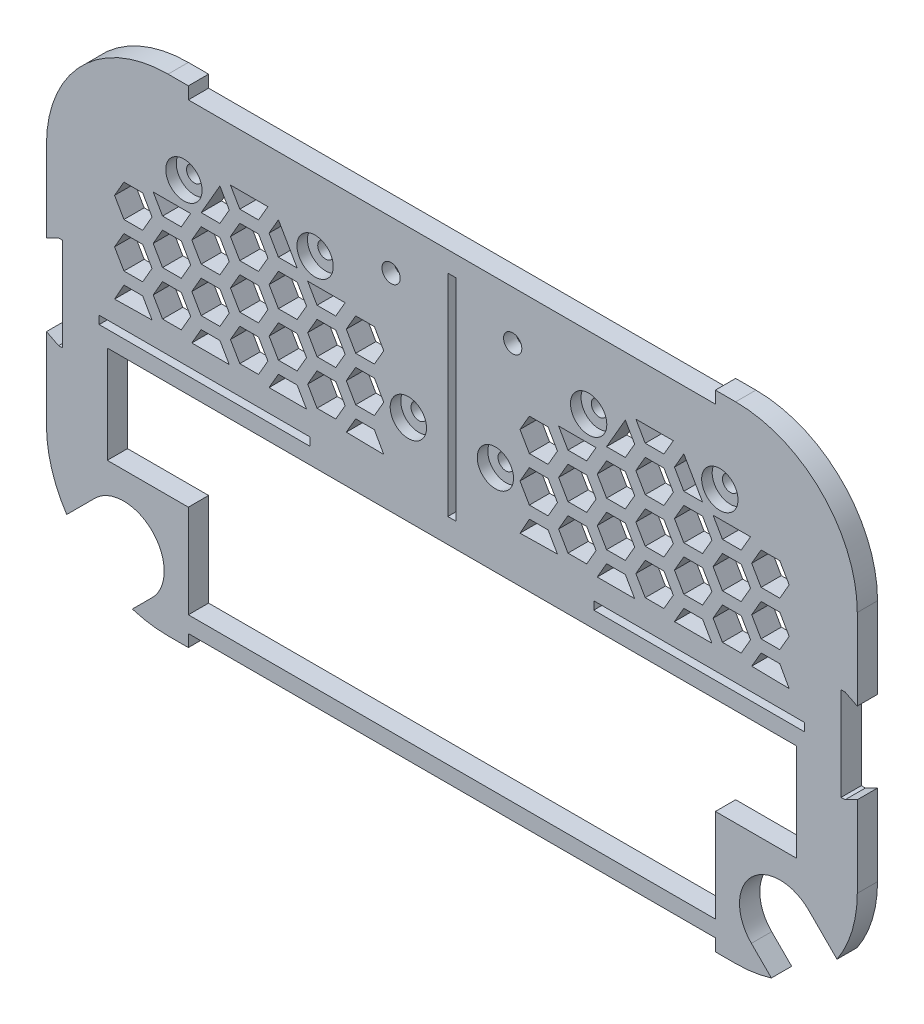
from build123d import *

# Parameters (mm, degrees)
EXTRUDE_1_DEPTH                = 5
SKETCH_2_R                     = 10
CUT_EXTRUDE_670_DEPTH          = 4
CUT_EXTRUDE_4_REACH            = 118.726
SKETCH_3_W                     = 130
SKETCH_3_H                     = 3
HOLE_WIZARD_M3_5_1_D           = 3.9
HOLE_WIZARD_M3_5_1_CBORE_D     = 8.96
HOLE_WIZARD_M3_5_1_CBORE_DEPTH = 2.6
CUT_EXTRUDE_5_DEPTH            = 117.726175299
CUT_EXTRUDE_5_DEPTH_BACK       = 117.726175299
SKETCH_8_W                     = 40
SKETCH_8_H                     = 5
CUT_EXTRUDE_7_DEPTH            = 3
HOLE_WIZARD_M4_1_D             = 4.5
HOLE_WIZARD_M4_1_CBORE_D       = 8
HOLE_WIZARD_M4_1_CBORE_DEPTH   = 2
CUT_EXTRUDE_8_DEPTH            = 10


with BuildPart() as part:
    # 草图1 → 凸台-拉伸1 (new body)
    with BuildSketch(Plane.XY):
        with BuildLine():
            Line((70, 60), (-70, 60))
            ThreePointArc((-70, 60), (-91.213203436, 51.213203436), (-100, 30))
            Line((-100, 30), (-100, -30))
            ThreePointArc((-100, -30), (-91.213203436, -51.213203436), (-70, -60))
            Line((-70, -60), (70, -60))
            ThreePointArc((70, -60), (91.213203436, -51.213203436), (100, -30))
            Line((100, -30), (100, 30))
            ThreePointArc((100, 30), (91.213203436, 51.213203436), (70, 60))
        make_face()
    extrude(amount=EXTRUDE_1_DEPTH)

    # 草图2 → Cut-Extrude 670 (cut)
    with BuildSketch(Plane.XY):
        with Locations((-80.94997709, 46.6721258)):
            Circle(SKETCH_2_R)
        with Locations((80.94997709, 46.6721258)):
            Circle(SKETCH_2_R)
    extrude(amount=CUT_EXTRUDE_670_DEPTH, mode=Mode.SUBTRACT)

    # 草图3 → 切除-拉伸4 (cut, up to next)
    with BuildSketch(Plane.XY, mode=Mode.PRIVATE) as cut_extrude_4_sk1:
        Polygon((-85, -6), (-85, -30), (-70, -30), (-65, -30), (-65, -53), (65, -53), (65, -30), (70, -30), (85, -30), (85, -6), align=None)
    cut_extrude_4_tool1 = extrude(cut_extrude_4_sk1.sketch, amount=CUT_EXTRUDE_4_REACH, mode=Mode.PRIVATE) & part.part
    # 草图3 → 切除-拉伸4 (cut, up to next)
    with BuildSketch(Plane.XY, mode=Mode.PRIVATE) as cut_extrude_4_sk2:
        with Locations((0, -58.5)):
            Rectangle(SKETCH_3_W, SKETCH_3_H)
    cut_extrude_4_tool2 = extrude(cut_extrude_4_sk2.sketch, amount=CUT_EXTRUDE_4_REACH, mode=Mode.PRIVATE) & part.part
    # 草图3 → 切除-拉伸4 (cut, up to next)
    with BuildSketch(Plane.XY, mode=Mode.PRIVATE) as cut_extrude_4_sk3:
        Polygon((-100, -10), (-97, -11.5), (-96, -11.5), (-96, 11.5), (-97, 11.5), (-100, 10), align=None)
    cut_extrude_4_tool3 = extrude(cut_extrude_4_sk3.sketch, amount=CUT_EXTRUDE_4_REACH, mode=Mode.PRIVATE) & part.part
    # 草图3 → 切除-拉伸4 (cut, up to next)
    with BuildSketch(Plane.XY, mode=Mode.PRIVATE) as cut_extrude_4_sk4:
        Polygon((87, 0), (87, -2), (35, -2), (35, 0), (37, 0), align=None)
    cut_extrude_4_tool4 = extrude(cut_extrude_4_sk4.sketch, amount=CUT_EXTRUDE_4_REACH, mode=Mode.PRIVATE) & part.part
    # 草图3 → 切除-拉伸4 (cut, up to next)
    with BuildSketch(Plane.XY, mode=Mode.PRIVATE) as cut_extrude_4_sk5:
        Polygon((-35, 0), (-35, -2), (-87, -2), (-87, 0), (-37, 0), align=None)
    cut_extrude_4_tool5 = extrude(cut_extrude_4_sk5.sketch, amount=CUT_EXTRUDE_4_REACH, mode=Mode.PRIVATE) & part.part
    # 草图3 → 切除-拉伸4 (cut, up to next)
    with BuildSketch(Plane.XY, mode=Mode.PRIVATE) as cut_extrude_4_sk6:
        Polygon((97, 11.5), (96, 11.5), (96, -11.5), (97, -11.5), (100, -10), (100, 10), align=None)
    cut_extrude_4_tool6 = extrude(cut_extrude_4_sk6.sketch, amount=CUT_EXTRUDE_4_REACH, mode=Mode.PRIVATE) & part.part
    # 草图3 → 切除-拉伸4 (cut, up to next)
    with BuildSketch(Plane.XY, mode=Mode.PRIVATE) as cut_extrude_4_sk7:
        Polygon((0, 0), (-1, 0), (-1, 50), (-1, 52), (1, 52), (1, 50), (1, 0), align=None)
    cut_extrude_4_tool7 = extrude(cut_extrude_4_sk7.sketch, amount=CUT_EXTRUDE_4_REACH, mode=Mode.PRIVATE) & part.part
    # 草图3 → 切除-拉伸4 (cut, up to next)
    with BuildSketch(Plane.XY, mode=Mode.PRIVATE) as cut_extrude_4_sk8:
        with Locations((0, 58.5)):
            Rectangle(SKETCH_3_W, SKETCH_3_H)
    cut_extrude_4_tool8 = extrude(cut_extrude_4_sk8.sketch, amount=CUT_EXTRUDE_4_REACH, mode=Mode.PRIVATE) & part.part
    add(cut_extrude_4_tool1.solids().sort_by_distance((0, -27.938472, 0))[0], mode=Mode.SUBTRACT)
    add(cut_extrude_4_tool2.solids().sort_by_distance((0, -58.5, 0))[0], mode=Mode.SUBTRACT)
    add(cut_extrude_4_tool3.solids().sort_by_distance((-97.948571, 0, 0))[0], mode=Mode.SUBTRACT)
    add(cut_extrude_4_tool4.solids().sort_by_distance((61, -1, 0))[0], mode=Mode.SUBTRACT)
    add(cut_extrude_4_tool5.solids().sort_by_distance((-61, -1, 0))[0], mode=Mode.SUBTRACT)
    add(cut_extrude_4_tool6.solids().sort_by_distance((97.948571, 0, 0))[0], mode=Mode.SUBTRACT)
    add(cut_extrude_4_tool7.solids().sort_by_distance((0, 26, 0))[0], mode=Mode.SUBTRACT)
    add(cut_extrude_4_tool8.solids().sort_by_distance((0, 58.5, 0))[0], mode=Mode.SUBTRACT)

    # M3.5 六角头机械螺钉的柱形沉头孔1 (through all)
    with Locations(Plane(origin=(-66.09513153, 39.33442184, 5), x_dir=(1, 0, 0), z_dir=(0, 0, 1))):
        with Locations((0, 0), (32.35917741, -0.06954171), (55.361697855, -23.07037596), (99.83108565, -0.06954171), (76.8285652, -23.07037596), (132.19026306, 0)):
            CounterBoreHole(HOLE_WIZARD_M3_5_1_D / 2, HOLE_WIZARD_M3_5_1_CBORE_D / 2, HOLE_WIZARD_M3_5_1_CBORE_DEPTH)

    # 草图5 → 切除-拉伸5 (cut, two sides: drawn at the far end of the back side and taken through both)
    with BuildSketch(Plane.XY.offset(-CUT_EXTRUDE_5_DEPTH_BACK)):
        Polygon((-35.854918405, 5.5), (-38.164319482, 9.5), (-42.783121635, 9.5), (-45.092522712, 5.5), align=None)
        Polygon((-26.328638963, 11), (-28.63804004, 15), (-33.256842194, 15), (-35.56624327, 11), (-33.256842194, 7), (-28.63804004, 7), align=None)
        Polygon((-16.802359522, 16.5), (-19.111760598, 20.5), (-23.730562752, 20.5), (-26.039963829, 16.5), (-23.730562752, 12.5), (-19.111760598, 12.5), align=None)
        Polygon((-35.854918405, 16.5), (-38.164319482, 20.5), (-42.783121635, 20.5), (-45.092522712, 16.5), (-42.783121635, 12.5), (-38.164319482, 12.5), align=None)
        Polygon((-26.328638963, 22), (-28.63804004, 26), (-33.256842194, 26), (-35.56624327, 22), (-33.256842194, 18), (-28.63804004, 18), align=None)
        Polygon((-16.802359522, 27.5), (-19.111760598, 31.5), (-23.730562752, 31.5), (-26.039963829, 27.5), (-23.730562752, 23.5), (-19.111760598, 23.5), align=None)
        Polygon((-35.854918405, 27.5), (-38.164319482, 31.5), (-42.783121635, 31.5), (-45.092522712, 27.5), (-42.783121635, 23.5), (-38.164319482, 23.5), align=None)
        Polygon((-35.56624327, 33), (-33.256842194, 29), (-28.63804004, 29), (-26.328638963, 33), align=None)
        Polygon((-42.783121635, 42.5), (-45.092522712, 38.5), (-42.783121635, 34.5), (-38.164319482, 34.5), align=None)
        Polygon((-45.381197846, 11), (-47.690598923, 15), (-52.309401077, 15), (-54.618802154, 11), (-52.309401077, 7), (-47.690598923, 7), align=None)
        Polygon((-45.381197846, 22), (-47.690598923, 26), (-52.309401077, 26), (-54.618802154, 22), (-52.309401077, 18), (-47.690598923, 18), align=None)
        Polygon((-45.381197846, 33), (-47.690598923, 37), (-52.309401077, 37), (-54.618802154, 33), (-52.309401077, 29), (-47.690598923, 29), align=None)
        Polygon((-54.907477288, 5.5), (-64.145081595, 5.5), (-61.835680518, 9.5), (-57.216878365, 9.5), align=None)
        Polygon((-64.43375673, 33), (-73.671361037, 33), (-71.36195996, 29), (-66.743157806, 29), align=None)
        Polygon((-57.216878365, 42.5), (-61.835680518, 34.5), (-57.216878365, 34.5), (-54.907477288, 38.5), align=None)
        Polygon((-61.835680518, 23.5), (-64.145081595, 27.5), (-61.835680518, 31.5), (-57.216878365, 31.5), (-54.907477288, 27.5), (-57.216878365, 23.5), align=None)
        Polygon((-80.888239402, 23.5), (-83.197640478, 27.5), (-80.888239402, 31.5), (-76.269437248, 31.5), (-73.960036171, 27.5), (-76.269437248, 23.5), align=None)
        Polygon((-71.36195996, 18), (-73.671361037, 22), (-71.36195996, 26), (-66.743157806, 26), (-64.43375673, 22), (-66.743157806, 18), align=None)
        Polygon((-61.835680518, 12.5), (-64.145081595, 16.5), (-61.835680518, 20.5), (-57.216878365, 20.5), (-54.907477288, 16.5), (-57.216878365, 12.5), align=None)
        Polygon((-80.888239402, 12.5), (-83.197640478, 16.5), (-80.888239402, 20.5), (-76.269437248, 20.5), (-73.960036171, 16.5), (-76.269437248, 12.5), align=None)
        Polygon((-71.36195996, 7), (-73.671361037, 11), (-71.36195996, 15), (-66.743157806, 15), (-64.43375673, 11), (-66.743157806, 7), align=None)
        Polygon((-52.309401077, 40), (-47.690598923, 40), (-45.381197846, 44), (-52.309401077, 44), (-54.618802154, 44), align=None)
        Polygon((-21.421161675, 9.5), (-23.730562752, 9.5), (-26.039963829, 5.5), (-16.802359522, 5.34174435), (-19.111760598, 9.5), align=None)
        Polygon((-80.888239402, 9.5), (-78.578838325, 9.5), (-76.269437248, 9.5), (-73.960036171, 5.5), (-83.197640478, 5.34174435), align=None)
        Polygon((78.578838325, 9.5), (76.269437248, 9.5), (73.960036171, 5.5), (83.197640478, 5.34174435), (80.888239402, 9.5), align=None)
        Polygon((19.111760598, 9.5), (21.421161675, 9.5), (23.730562752, 9.5), (26.039963829, 5.5), (16.802359522, 5.34174435), align=None)
        Polygon((45.381197846, 44), (47.690598923, 40), (52.309401077, 40), (54.618802154, 44), (52.309401077, 44), align=None)
        Polygon((64.145081595, 5.5), (61.835680518, 9.5), (57.216878365, 9.5), (54.907477288, 5.5), align=None)
        Polygon((73.671361037, 11), (71.36195996, 15), (66.743157806, 15), (64.43375673, 11), (66.743157806, 7), (71.36195996, 7), align=None)
        Polygon((83.197640478, 16.5), (80.888239402, 20.5), (76.269437248, 20.5), (73.960036171, 16.5), (76.269437248, 12.5), (80.888239402, 12.5), align=None)
        Polygon((64.145081595, 16.5), (61.835680518, 20.5), (57.216878365, 20.5), (54.907477288, 16.5), (57.216878365, 12.5), (61.835680518, 12.5), align=None)
        Polygon((73.671361037, 22), (71.36195996, 26), (66.743157806, 26), (64.43375673, 22), (66.743157806, 18), (71.36195996, 18), align=None)
        Polygon((83.197640478, 27.5), (80.888239402, 31.5), (76.269437248, 31.5), (73.960036171, 27.5), (76.269437248, 23.5), (80.888239402, 23.5), align=None)
        Polygon((64.145081595, 27.5), (61.835680518, 31.5), (57.216878365, 31.5), (54.907477288, 27.5), (57.216878365, 23.5), (61.835680518, 23.5), align=None)
        Polygon((64.43375673, 33), (66.743157806, 29), (71.36195996, 29), (73.671361037, 33), align=None)
        Polygon((57.216878365, 42.5), (54.907477288, 38.5), (57.216878365, 34.5), (61.835680518, 34.5), align=None)
        Polygon((45.092522712, 5.5), (35.854918405, 5.5), (38.164319482, 9.5), (42.783121635, 9.5), align=None)
        Polygon((35.56624327, 33), (26.328638963, 33), (28.63804004, 29), (33.256842194, 29), align=None)
        Polygon((42.783121635, 42.5), (38.164319482, 34.5), (42.783121635, 34.5), (45.092522712, 38.5), align=None)
        Polygon((47.690598923, 29), (45.381197846, 33), (47.690598923, 37), (52.309401077, 37), (54.618802154, 33), (52.309401077, 29), align=None)
        Polygon((47.690598923, 18), (45.381197846, 22), (47.690598923, 26), (52.309401077, 26), (54.618802154, 22), (52.309401077, 18), align=None)
        Polygon((47.690598923, 7), (45.381197846, 11), (47.690598923, 15), (52.309401077, 15), (54.618802154, 11), (52.309401077, 7), align=None)
        Polygon((38.164319482, 23.5), (35.854918405, 27.5), (38.164319482, 31.5), (42.783121635, 31.5), (45.092522712, 27.5), (42.783121635, 23.5), align=None)
        Polygon((19.111760598, 23.5), (16.802359522, 27.5), (19.111760598, 31.5), (23.730562752, 31.5), (26.039963829, 27.5), (23.730562752, 23.5), align=None)
        Polygon((28.63804004, 18), (26.328638963, 22), (28.63804004, 26), (33.256842194, 26), (35.56624327, 22), (33.256842194, 18), align=None)
        Polygon((38.164319482, 12.5), (35.854918405, 16.5), (38.164319482, 20.5), (42.783121635, 20.5), (45.092522712, 16.5), (42.783121635, 12.5), align=None)
        Polygon((19.111760598, 12.5), (16.802359522, 16.5), (19.111760598, 20.5), (23.730562752, 20.5), (26.039963829, 16.5), (23.730562752, 12.5), align=None)
        Polygon((28.63804004, 7), (26.328638963, 11), (28.63804004, 15), (33.256842194, 15), (35.56624327, 11), (33.256842194, 7), align=None)
    extrude(amount=CUT_EXTRUDE_5_DEPTH + CUT_EXTRUDE_5_DEPTH_BACK, mode=Mode.SUBTRACT)

    # 草图8 → 切除-拉伸7 (cut)
    with BuildSketch(Plane.XY):
        with Locations((-46, 49.5)):
            Rectangle(SKETCH_8_W, SKETCH_8_H)
        with Locations((46, 49.5)):
            Rectangle(SKETCH_8_W, SKETCH_8_H)
    extrude(amount=CUT_EXTRUDE_7_DEPTH, mode=Mode.SUBTRACT)

    # M4 六角凹头盖的柱孔1 (through all)
    with Locations(Plane(origin=(-15, 45, 0), x_dir=(-1, 0, 0), z_dir=(0, 0, -1))):
        with Locations((0, 0), (-30, 0)):
            CounterBoreHole(HOLE_WIZARD_M4_1_D / 2, HOLE_WIZARD_M4_1_CBORE_D / 2, HOLE_WIZARD_M4_1_CBORE_DEPTH)

    # 草图2<8> → 切除-拉伸8 (cut)
    with BuildSketch(Plane.XY):
        with BuildLine():
            Line((95.001240536, -58.676542717), (95.001240536, -46.581253622))
            Line((95.001240536, -46.581253622), (88.021044902, -39.601057988))
            ThreePointArc((88.021044902, -39.601057988), (73.878909278, -39.601057988), (73.878909278, -53.743193612))
            Line((73.878909278, -53.743193612), (78.812258383, -58.676542717))
            Line((78.812258383, -58.676542717), (95.001240536, -58.676542717))
        make_face()
        with BuildLine():
            Line((-78.812258383, -58.676542717), (-73.878909278, -53.743193612))
            ThreePointArc((-73.878909278, -53.743193612), (-73.878909278, -39.601057988), (-88.021044902, -39.601057988))
            Line((-88.021044902, -39.601057988), (-95.001240536, -46.581253622))
            Line((-95.001240536, -46.581253622), (-95.001240536, -58.676542717))
            Line((-95.001240536, -58.676542717), (-78.812258383, -58.676542717))
        make_face()
    extrude(amount=CUT_EXTRUDE_8_DEPTH, mode=Mode.SUBTRACT)


solid = part.part
